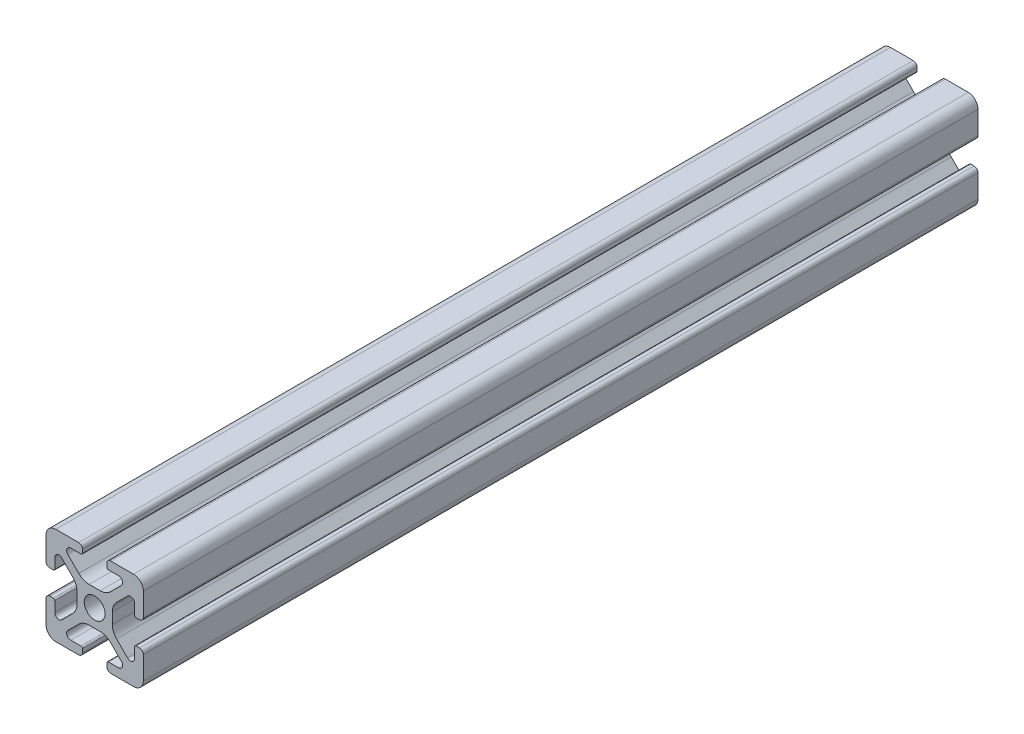
from build123d import *

# Parameters (mm, degrees)
SKETCH1_R           = 2.1463
BOSS_EXTRUDE1_DEPTH = 85.725


with BuildPart() as part:
    # Sketch1 → Boss-Extrude1 (new, symmetric)
    with BuildSketch(Plane.XY):
        with BuildLine():
            Line((-9.9949, 7.9883), (-9.9949, 3.2893))
            ThreePointArc((-9.9949, 3.2893), (-9.76427588, 2.73252412), (-9.2075, 2.5019))
            Line((-9.2075, 2.5019), (-8.4963, 2.5019))
            ThreePointArc((-8.4963, 2.5019), (-8.280773853, 2.591173853), (-8.1915, 2.8067))
            Line((-8.1915, 2.8067), (-8.1915, 4.9149))
            ThreePointArc((-8.1915, 4.9149), (-7.674065253, 5.689295824), (-6.760603096, 5.507596904))
            Line((-6.760603096, 5.507596904), (-4.505765747, 3.252759555))
            ThreePointArc((-4.505765747, 3.252759555), (-3.856054457, 2.280397894), (-3.627906192, 1.133419111))
            Line((-3.627906192, 1.133419111), (-3.627906192, -1.133419111))
            ThreePointArc((-3.627906192, -1.133419111), (-3.856054457, -2.280397894), (-4.505765747, -3.252759555))
            Line((-4.505765747, -3.252759555), (-6.760603096, -5.507596904))
            ThreePointArc((-6.760603096, -5.507596904), (-7.674065253, -5.689295824), (-8.1915, -4.9149))
            Line((-8.1915, -4.9149), (-8.1915, -2.8067))
            ThreePointArc((-8.1915, -2.8067), (-8.280773853, -2.591173853), (-8.4963, -2.5019))
            Line((-8.4963, -2.5019), (-9.2075, -2.5019))
            ThreePointArc((-9.2075, -2.5019), (-9.76427588, -2.73252412), (-9.9949, -3.2893))
            Line((-9.9949, -3.2893), (-9.9949, -7.9883))
            ThreePointArc((-9.9949, -7.9883), (-9.407180467, -9.407180467), (-7.9883, -9.9949))
            Line((-7.9883, -9.9949), (-3.2893, -9.9949))
            ThreePointArc((-3.2893, -9.9949), (-2.73252412, -9.76427588), (-2.5019, -9.2075))
            Line((-2.5019, -9.2075), (-2.5019, -8.4963))
            ThreePointArc((-2.5019, -8.4963), (-2.591173853, -8.280773853), (-2.8067, -8.1915))
            Line((-2.8067, -8.1915), (-4.9149, -8.1915))
            ThreePointArc((-4.9149, -8.1915), (-5.689295824, -7.674065253), (-5.507596904, -6.760603096))
            Line((-5.507596904, -6.760603096), (-3.252759555, -4.505765747))
            ThreePointArc((-3.252759555, -4.505765747), (-2.280397894, -3.856054457), (-1.133419111, -3.627906192))
            Line((-1.133419111, -3.627906192), (1.133419111, -3.627906192))
            ThreePointArc((1.133419111, -3.627906192), (2.280397894, -3.856054457), (3.252759555, -4.505765747))
            Line((3.252759555, -4.505765747), (5.507596904, -6.760603096))
            ThreePointArc((5.507596904, -6.760603096), (5.689295824, -7.674065253), (4.9149, -8.1915))
            Line((4.9149, -8.1915), (2.8067, -8.1915))
            ThreePointArc((2.8067, -8.1915), (2.591173853, -8.280773853), (2.5019, -8.4963))
            Line((2.5019, -8.4963), (2.5019, -9.2075))
            ThreePointArc((2.5019, -9.2075), (2.73252412, -9.76427588), (3.2893, -9.9949))
            Line((3.2893, -9.9949), (7.9883, -9.9949))
            ThreePointArc((7.9883, -9.9949), (9.407180467, -9.407180467), (9.9949, -7.9883))
            Line((9.9949, -7.9883), (9.9949, -3.2893))
            ThreePointArc((9.9949, -3.2893), (9.76427588, -2.73252412), (9.2075, -2.5019))
            Line((9.2075, -2.5019), (8.4963, -2.5019))
            ThreePointArc((8.4963, -2.5019), (8.280773853, -2.591173853), (8.1915, -2.8067))
            Line((8.1915, -2.8067), (8.1915, -4.9149))
            ThreePointArc((8.1915, -4.9149), (7.674065253, -5.689295824), (6.760603096, -5.507596904))
            Line((6.760603096, -5.507596904), (4.505765747, -3.252759555))
            ThreePointArc((4.505765747, -3.252759555), (3.856054457, -2.280397894), (3.627906192, -1.133419111))
            Line((3.627906192, -1.133419111), (3.627906192, 1.133419111))
            ThreePointArc((3.627906192, 1.133419111), (3.856054457, 2.280397894), (4.505765747, 3.252759555))
            Line((4.505765747, 3.252759555), (6.760603096, 5.507596904))
            ThreePointArc((6.760603096, 5.507596904), (7.674065253, 5.689295824), (8.1915, 4.9149))
            Line((8.1915, 4.9149), (8.1915, 2.8067))
            ThreePointArc((8.1915, 2.8067), (8.280773853, 2.591173853), (8.4963, 2.5019))
            Line((8.4963, 2.5019), (9.2075, 2.5019))
            ThreePointArc((9.2075, 2.5019), (9.76427588, 2.73252412), (9.9949, 3.2893))
            Line((9.9949, 3.2893), (9.9949, 7.9883))
            ThreePointArc((9.9949, 7.9883), (9.407180467, 9.407180467), (7.9883, 9.9949))
            Line((7.9883, 9.9949), (3.2893, 9.9949))
            ThreePointArc((3.2893, 9.9949), (2.73252412, 9.76427588), (2.5019, 9.2075))
            Line((2.5019, 9.2075), (2.5019, 8.4963))
            ThreePointArc((2.5019, 8.4963), (2.591173853, 8.280773853), (2.8067, 8.1915))
            Line((2.8067, 8.1915), (4.9149, 8.1915))
            ThreePointArc((4.9149, 8.1915), (5.689295824, 7.674065253), (5.507596904, 6.760603096))
            Line((5.507596904, 6.760603096), (3.252759555, 4.505765747))
            ThreePointArc((3.252759555, 4.505765747), (2.280397894, 3.856054457), (1.133419111, 3.627906192))
            Line((1.133419111, 3.627906192), (-1.133419111, 3.627906192))
            ThreePointArc((-1.133419111, 3.627906192), (-2.280397894, 3.856054457), (-3.252759555, 4.505765747))
            Line((-3.252759555, 4.505765747), (-5.507596904, 6.760603096))
            ThreePointArc((-5.507596904, 6.760603096), (-5.689295824, 7.674065253), (-4.9149, 8.1915))
            Line((-4.9149, 8.1915), (-2.8067, 8.1915))
            ThreePointArc((-2.8067, 8.1915), (-2.591173853, 8.280773853), (-2.5019, 8.4963))
            Line((-2.5019, 8.4963), (-2.5019, 9.2075))
            ThreePointArc((-2.5019, 9.2075), (-2.73252412, 9.76427588), (-3.2893, 9.9949))
            Line((-3.2893, 9.9949), (-7.9883, 9.9949))
            ThreePointArc((-7.9883, 9.9949), (-9.407180467, 9.407180467), (-9.9949, 7.9883))
        make_face()
        Circle(SKETCH1_R, mode=Mode.SUBTRACT)
    extrude(amount=BOSS_EXTRUDE1_DEPTH, both=True)


solid = part.part
